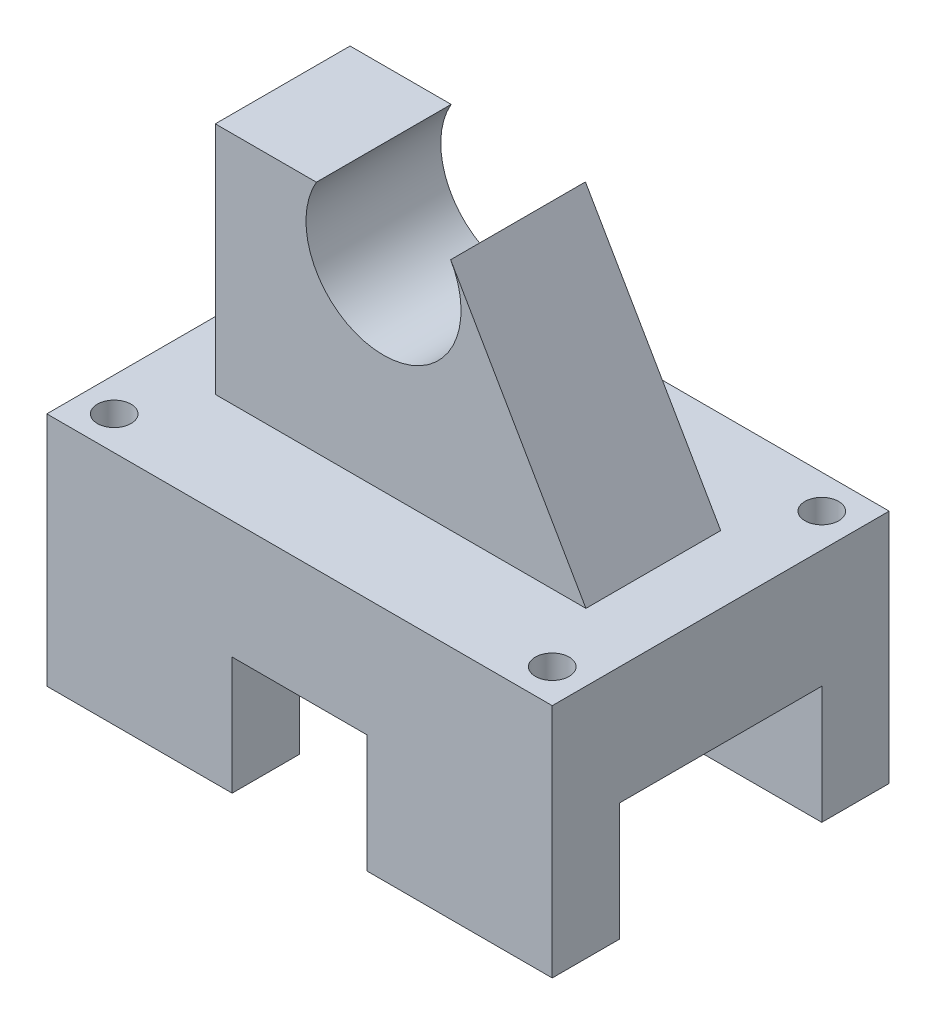
from build123d import *

# Parameters (mm, degrees)
SKETCH1_W                = 150
SKETCH1_H                = 70
BOSS_EXTRUDE1_DEPTH      = 100
SKETCH2_W                = 40
SKETCH2_H                = 35
CUT_EXTRUDE1_DEPTH       = 100
SKETCH3_W                = 60
SKETCH3_H                = 35
CUT_EXTRUDE2_DEPTH       = 150
BOSS_EXTRUDE2_DEPTH      = 20
BOSS_EXTRUDE2_DEPTH_BACK = 20
SKETCH11_R               = 5
CUT_EXTRUDE4_DEPTH       = 50


with BuildPart() as part:
    # Sketch1 → Boss-Extrude1 (new body)
    with BuildSketch(Plane.XY):
        Rectangle(SKETCH1_W, SKETCH1_H)
    extrude(amount=BOSS_EXTRUDE1_DEPTH)

    # Sketch2 → Cut-Extrude1 (cut)
    with BuildSketch(Plane.XY.offset(100)):
        with Locations((0, -17.5)):
            Rectangle(SKETCH2_W, SKETCH2_H)
    extrude(amount=-CUT_EXTRUDE1_DEPTH, mode=Mode.SUBTRACT)

    # Sketch3 → Cut-Extrude2 (cut)
    with BuildSketch(Plane(origin=(75, 0, 0), x_dir=(0, 0, -1), z_dir=(1, 0, 0))):
        with Locations((-50, -17.5)):
            Rectangle(SKETCH3_W, SKETCH3_H)
    extrude(amount=-CUT_EXTRUDE2_DEPTH, mode=Mode.SUBTRACT)

    # Sketch5 → Boss-Extrude2 (add, two sides: drawn at the far end of the back side and taken through both)
    with BuildSketch(Plane.XY.offset(50).offset(-BOSS_EXTRUDE2_DEPTH_BACK)):
        with BuildLine():
            Line((55, 35), (14.850112855, 104.541644453))
            ThreePointArc((14.850112855, 104.541644453), (-5.074943572, 70.030434377), (-25, 104.541644453))
            Line((-25, 104.541644453), (-55, 104.541644453))
            Line((-55, 104.541644453), (-55, 35))
            Line((-55, 35), (55, 35))
        make_face()
    extrude(amount=BOSS_EXTRUDE2_DEPTH + BOSS_EXTRUDE2_DEPTH_BACK)

    # Sketch11 → Cut-Extrude4 (cut)
    with BuildSketch(Plane(origin=(0, 35, 0), x_dir=(1, 0, 0), z_dir=(0, 1, 0))):
        with Locations(Location((65, -10, 0), (0, 0, 270))):
            Circle(SKETCH11_R)
        with Locations(Location((-65, -10, 0), (0, 0, 270))):
            Circle(SKETCH11_R)
        with Locations(Location((-65, -90, 0), (0, 0, 270))):
            Circle(SKETCH11_R)
        with Locations(Location((65, -90, 0), (0, 0, 270))):
            Circle(SKETCH11_R)
    extrude(amount=-CUT_EXTRUDE4_DEPTH, mode=Mode.SUBTRACT)


solid = part.part
